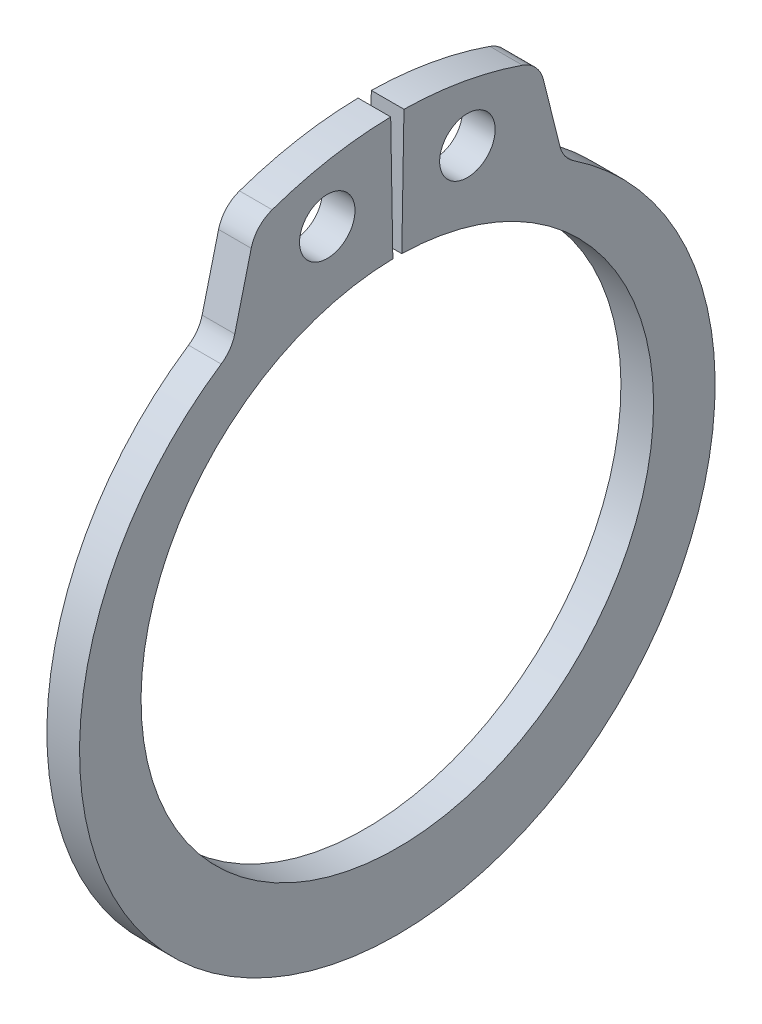
from build123d import *

# Parameters (mm, degrees)
SKETCH1_R      = 0.85
EXTRUDE1_DEPTH = 0.5
FILLET1_R      = 1


with BuildPart() as part:
    # Sketch1 → Extrude1 (new, symmetric)
    with BuildSketch(Plane(origin=(0, 0, 0), x_dir=(0, 0, -1), z_dir=(1, 0, 0))):
        with BuildLine():
            Line((-0.137001391, 7.848804407), (-0.203320535, 11.648225649))
            ThreePointArc((-0.203320535, 11.648225649), (-2.314404903, 11.417794443), (-4.34858642, 10.80797373))
            Line((-4.34858642, 10.80797373), (-5.075594765, 7.892102523))
            ThreePointArc((-5.075594765, 7.892102523), (0, -10.15), (5.075594765, 7.892102523))
            Line((5.075594765, 7.892102523), (4.34858642, 10.80797373))
            ThreePointArc((4.34858642, 10.80797373), (2.314404903, 11.417794443), (0.203320535, 11.648225649))
            Line((0.203320535, 11.648225649), (0.137001391, 7.848804407))
            ThreePointArc((0.137001391, 7.848804407), (0, -7.85), (-0.137001391, 7.848804407))
        make_face()
        with Locations((-2.146646476, 9.714015345)):
            Circle(SKETCH1_R, mode=Mode.SUBTRACT)
        with Locations((2.146646476, 9.714015345)):
            Circle(SKETCH1_R, mode=Mode.SUBTRACT)
    extrude(amount=EXTRUDE1_DEPTH, both=True)

    # Fillet1
    fillet1_edges = [part.edges().sort_by_distance(p)[0] for p in [
        (0, 10.80797373, -4.34858642),
        (0, 7.892102523, -5.075594765),
        (0, 7.892102523, 5.075594765),
        (0, 10.80797373, 4.34858642),
    ]]
    fillet(fillet1_edges, radius=FILLET1_R)


solid = part.part
